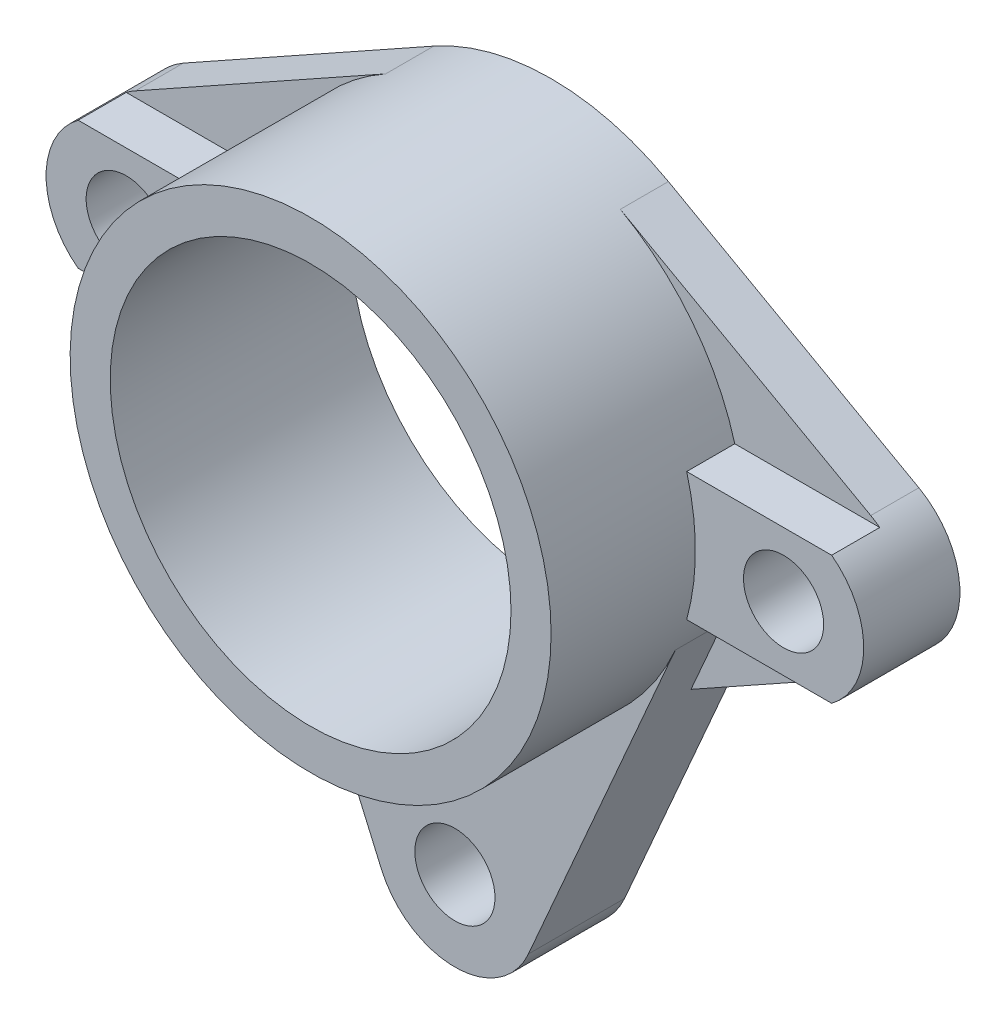
from build123d import *

# Parameters (mm, degrees)
SKETCH1_R             = 5
BOSS_EXTRUDE1_DEPTH   = 12
BOSS_EXTRUDE1_2_DEPTH = 12
BOSS_EXTRUDE1_3_DEPTH = 12
BOSS_EXTRUDE2_DEPTH   = 6
SKETCH1_4_R           = 25
BOSS_EXTRUDE3_DEPTH   = 30


with BuildPart() as part:
    # Sketch1 → Boss-Extrude1 (new body)
    with BuildSketch(Plane.XY):
        with BuildLine():
            ThreePointArc((47, -8), (51, 0), (47, 8))
            Line((47, 8), (28.91366459, 8))
            ThreePointArc((28.91366459, 8), (30, 0), (28.91366459, -8))
            Line((28.91366459, -8), (47, -8))
        make_face()
        with Locations((41, 0)):
            Circle(SKETCH1_R, mode=Mode.SUBTRACT)
    extrude(amount=BOSS_EXTRUDE1_DEPTH)



with BuildPart() as body_2:
    # Sketch1 → Boss-Extrude1 2 (new body)
    with BuildSketch(Plane.XY):
        with BuildLine():
            ThreePointArc((-28.91366459, -8), (-30, 0), (-28.91366459, 8))
            Line((-28.91366459, 8), (-47, 8))
            ThreePointArc((-47, 8), (-51, 0), (-47, -8))
            Line((-47, -8), (-28.91366459, -8))
        make_face()
        with Locations((-41, 0)):
            Circle(SKETCH1_R, mode=Mode.SUBTRACT)
    extrude(amount=BOSS_EXTRUDE1_2_DEPTH)


with BuildPart() as body_3:
    # Sketch1 → Boss-Extrude1 3 (new body)
    with BuildSketch(Plane.XY):
        with BuildLine():
            Line((9.16515139, -54), (27.49545417, -12))
            ThreePointArc((27.49545417, -12), (0, -30), (-27.49545417, -12))
            Line((-27.49545417, -12), (-9.16515139, -54))
            ThreePointArc((-9.16515139, -54), (0, -60), (9.16515139, -54))
        make_face()
        with Locations((0, -50)):
            Circle(SKETCH1_R, mode=Mode.SUBTRACT)
    extrude(amount=BOSS_EXTRUDE1_3_DEPTH)


with BuildPart() as part_1:
    add(part.part)

    add(body_2.part)  # Boss-Extrude2 merges body 2

    add(body_3.part)  # Boss-Extrude2 merges body 3
    # Sketch1<3> → Boss-Extrude2 (add)
    with BuildSketch(Plane.XY):
        with BuildLine():
            ThreePointArc((47, 8), (46.451241941, 8.383553024), (45.87804878, 8.729526911))
            Line((45.87804878, 8.729526911), (14.634146341, 26.188580734))
            ThreePointArc((14.634146341, 26.188580734), (23.596802252, 18.52541291), (28.91366459, 8))
            Line((28.91366459, 8), (47, 8))
        make_face()
        with BuildLine():
            ThreePointArc((-28.91366459, 8), (-23.596802252, 18.52541291), (-14.634146341, 26.188580734))
            Line((-14.634146341, 26.188580734), (-45.87804878, 8.729526911))
            ThreePointArc((-45.87804878, 8.729526911), (-46.451241941, 8.383553024), (-47, 8))
            Line((-47, 8), (-28.91366459, 8))
        make_face()
        with BuildLine():
            ThreePointArc((45.87804878, -8.729526911), (46.451241941, -8.383553024), (47, -8))
            Line((47, -8), (28.91366459, -8))
            ThreePointArc((28.91366459, -8), (28.275380984, -10.025109984), (27.49545417, -12))
            Line((27.49545417, -12), (23.454044644, -21.260032532))
            Line((23.454044644, -21.260032532), (45.87804878, -8.729526911))
        make_face()
        with BuildLine():
            ThreePointArc((-27.49545417, -12), (-28.275380984, -10.025109984), (-28.91366459, -8))
            Line((-28.91366459, -8), (-47, -8))
            ThreePointArc((-47, -8), (-46.451241941, -8.383553024), (-45.87804878, -8.729526911))
            Line((-45.87804878, -8.729526911), (-23.454044644, -21.260032532))
            Line((-23.454044644, -21.260032532), (-27.49545417, -12))
        make_face()
    extrude(amount=BOSS_EXTRUDE2_DEPTH)

    # Sketch1<4> → Boss-Extrude3 (add)
    with BuildSketch(Plane.XY):
        with BuildLine():
            ThreePointArc((28.91366459, 8), (23.596802252, 18.52541291), (14.634146341, 26.188580734))
            ThreePointArc((14.634146341, 26.188580734), (0, 30), (-14.634146341, 26.188580734))
            ThreePointArc((-14.634146341, 26.188580734), (-23.596802252, 18.52541291), (-28.91366459, 8))
            ThreePointArc((-28.91366459, 8), (-30, 0), (-28.91366459, -8))
            ThreePointArc((-28.91366459, -8), (-28.275380984, -10.025109984), (-27.49545417, -12))
            ThreePointArc((-27.49545417, -12), (0, -30), (27.49545417, -12))
            ThreePointArc((27.49545417, -12), (28.275380984, -10.025109984), (28.91366459, -8))
            ThreePointArc((28.91366459, -8), (29.727175595, -4.036710437), (30, 0))
            ThreePointArc((30, 0), (29.727175595, 4.036710437), (28.91366459, 8))
        make_face()
        Circle(SKETCH1_4_R, mode=Mode.SUBTRACT)
    extrude(amount=BOSS_EXTRUDE3_DEPTH)


solid = part_1.part
